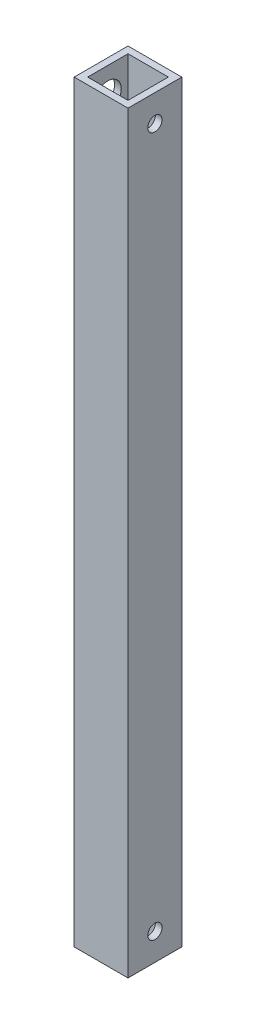
from build123d import *

# Parameters (mm, degrees)
SKETCH1_W           = 25.4
SKETCH1_H           = 25.4
SKETCH1_W_2         = 19.05
SKETCH1_H_2         = 19.05
BOSS_EXTRUDE1_DEPTH = 355.6
SKETCH2_R           = 3.3734375
CUT_EXTRUDE1_DEPTH  = 358.409680899
CUT_EXTRUDE2_REACH  = 359.41
SKETCH3_R           = 6.35


with BuildPart() as part:
    # Sketch1 → Boss-Extrude1 (new body)
    with BuildSketch(Plane(origin=(0, 0, 0), x_dir=(1, 0, 0), z_dir=(0, 1, 0))):
        with Locations((12.7, 12.7)):
            Rectangle(SKETCH1_W, SKETCH1_H)
        with Locations((12.7, 12.7)):
            Rectangle(SKETCH1_W_2, SKETCH1_H_2, mode=Mode.SUBTRACT)
    extrude(amount=BOSS_EXTRUDE1_DEPTH)

    # Sketch2 → Cut-Extrude1 (cut, through all)
    with BuildSketch(Plane(origin=(25.4, 0, 0), x_dir=(0, 0, -1), z_dir=(1, 0, 0))):
        with Locations((12.7, 12.7)):
            Circle(SKETCH2_R)
    cut_extrude1 = extrude(amount=-CUT_EXTRUDE1_DEPTH, mode=Mode.SUBTRACT)

    # Mirror1: Cut-Extrude1 across plane
    add(cut_extrude1.mirror(Plane.ZX.offset(177.8)), mode=Mode.SUBTRACT)

    # Sketch3 → Cut-Extrude2 (cut, up to next)
    with BuildSketch(Plane.ZY, mode=Mode.PRIVATE) as cut_extrude2_sk1:
        with Locations((-12.7, 342.9)):
            Circle(SKETCH3_R)
    cut_extrude2_tool1 = extrude(cut_extrude2_sk1.sketch, amount=-CUT_EXTRUDE2_REACH, mode=Mode.PRIVATE) & part.part
    # Sketch3 → Cut-Extrude2 (cut, up to next)
    with BuildSketch(Plane.ZY, mode=Mode.PRIVATE) as cut_extrude2_sk2:
        with Locations((-12.7, 12.7)):
            Circle(SKETCH3_R)
    cut_extrude2_tool2 = extrude(cut_extrude2_sk2.sketch, amount=-CUT_EXTRUDE2_REACH, mode=Mode.PRIVATE) & part.part
    add(cut_extrude2_tool1.solids().sort_by_distance((0, 342.9, -12.7))[0], mode=Mode.SUBTRACT)
    add(cut_extrude2_tool2.solids().sort_by_distance((0, 12.7, -12.7))[0], mode=Mode.SUBTRACT)


solid = part.part
